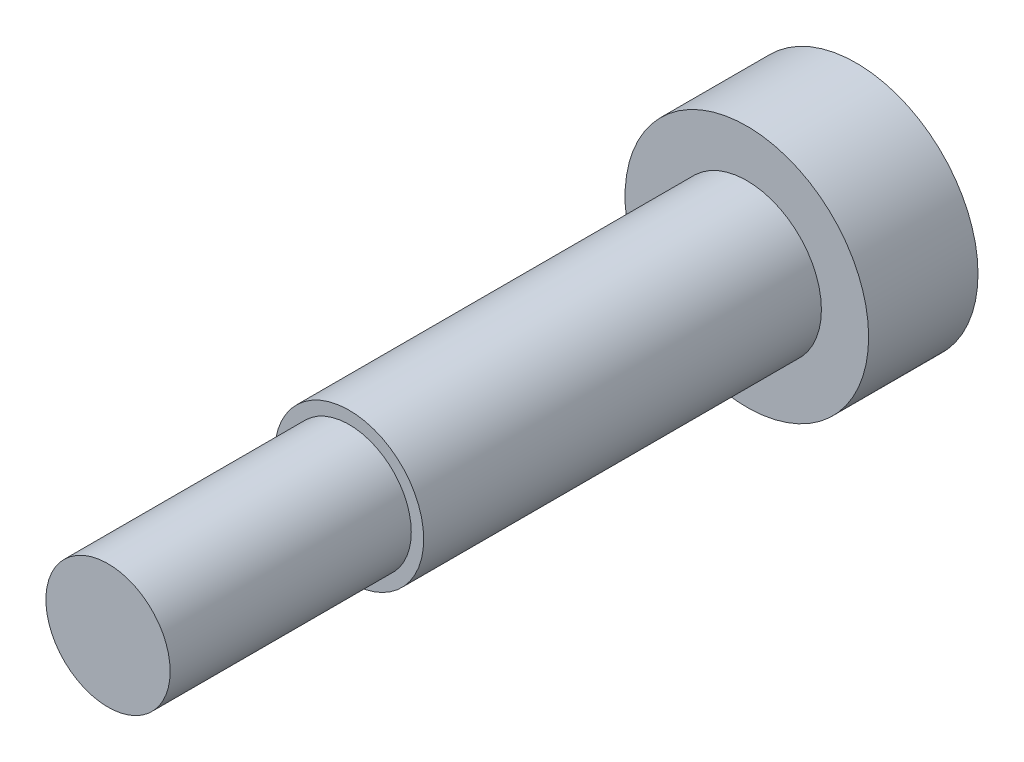
from build123d import *

# Parameters (mm, degrees)
SKETCH_1_R          = 4.9
EXTRUDE_1_DEPTH     = 4.4
SKETCH_2_R          = 3
EXTRUDE_2_DEPTH     = 16
SKETCH_3_R          = 2.5
EXTRUDE_3_DEPTH     = 9.7
CUT_EXTRUDE_1_DEPTH = 2


with BuildPart() as part:
    # 草图1 → 凸台-拉伸1 (new body)
    with BuildSketch(Plane.XY):
        Circle(SKETCH_1_R)
    extrude(amount=EXTRUDE_1_DEPTH)

    # 草图2 → 凸台-拉伸2 (add)
    with BuildSketch(Plane.XY.offset(4.4)):
        Circle(SKETCH_2_R)
    extrude(amount=EXTRUDE_2_DEPTH)

    # 草图3 → 凸台-拉伸3 (add)
    with BuildSketch(Plane.XY.offset(20.4)):
        Circle(SKETCH_3_R)
    extrude(amount=EXTRUDE_3_DEPTH)

    # 草图4 → 切除-拉伸1 (cut)
    with BuildSketch(Plane(origin=(0, 0, 0), x_dir=(-1, 0, 0), z_dir=(0, 0, -1))):
        Polygon((0, 1.732050808), (-1.5, 0.866025404), (-1.5, -0.866025404), (0, -1.732050808), (1.5, -0.866025404), (1.5, 0.866025404), align=None)
    extrude(amount=-CUT_EXTRUDE_1_DEPTH, mode=Mode.SUBTRACT)


solid = part.part
